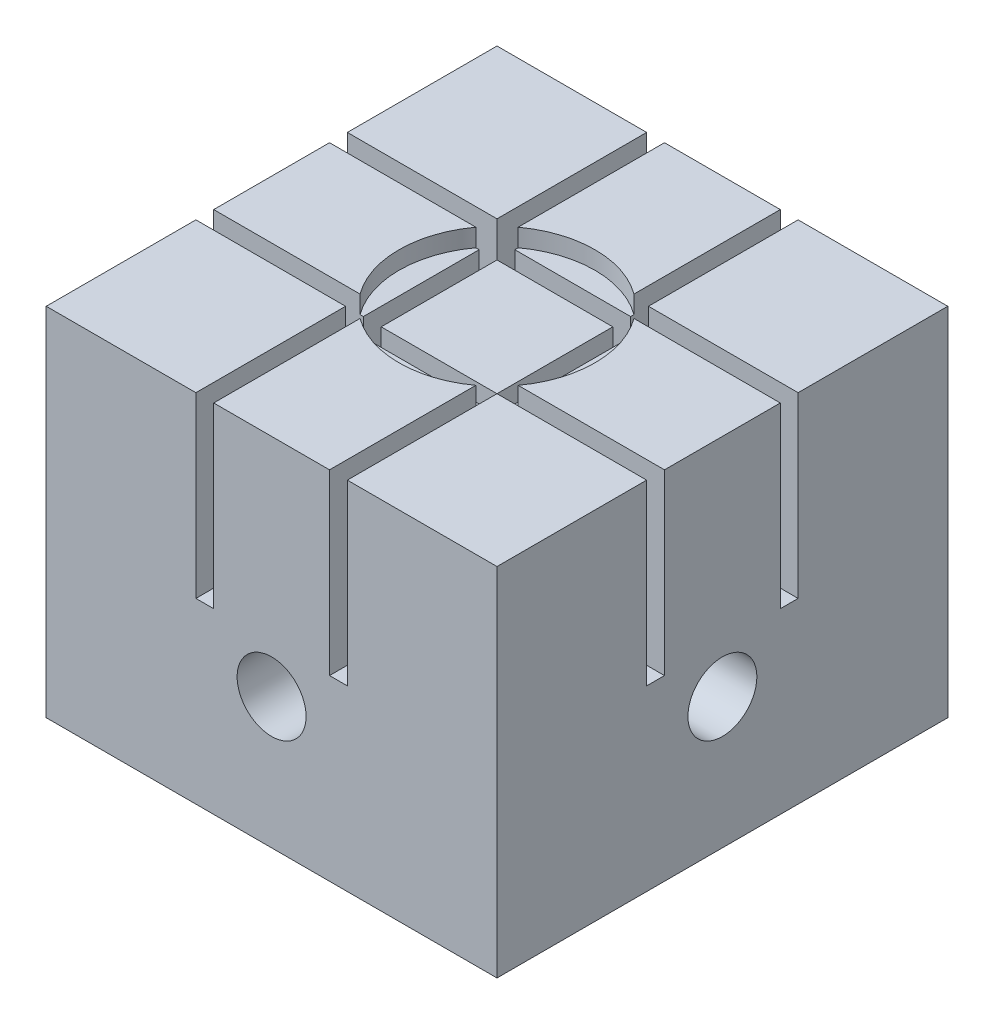
from build123d import *

# Parameters (mm, degrees)
SKETCH1_W                        = 32.131
SKETCH1_H                        = 25.4
BOSS_EXTRUDE1_DEPTH              = 32.131
SKETCH2_W                        = 1.27
SKETCH2_H                        = 32.131
SKETCH2_W_2                      = 32.131
SKETCH2_H_2                      = 1.27
CUT_EXTRUDE1_DEPTH               = 12.7
SKETCH3_R                        = 6.985
CUT_EXTRUDE2_DEPTH               = 1.27
F_10_0_1935_DIAMETER_HOLE6_D     = 4.9149
F_10_0_1935_DIAMETER_HOLE6_DEPTH = 7.62
F_10_0_1935_DIAMETER_HOLE6_TIP   = 1.476584928
F_10_0_1935_DIAMETER_HOLE7_D     = 4.9149
F_10_0_1935_DIAMETER_HOLE7_DEPTH = 7.62
F_10_0_1935_DIAMETER_HOLE7_TIP   = 1.476584928
F_10_0_1935_DIAMETER_HOLE8_D     = 4.9149
F_10_0_1935_DIAMETER_HOLE8_DEPTH = 7.62
F_10_0_1935_DIAMETER_HOLE8_TIP   = 1.476584928
F_10_0_1935_DIAMETER_HOLE9_D     = 4.9149
F_10_0_1935_DIAMETER_HOLE9_DEPTH = 7.62
F_10_0_1935_DIAMETER_HOLE9_TIP   = 1.476584928


with BuildPart() as part:
    # Sketch1 → Boss-Extrude1 (new body)
    with BuildSketch(Plane.XY):
        with Locations((0, 3.3655)):
            Rectangle(SKETCH1_W, SKETCH1_H)
    extrude(amount=BOSS_EXTRUDE1_DEPTH)

    # Sketch2 → Cut-Extrude1 (cut)
    with BuildSketch(Plane(origin=(0, 16.0655, 0), x_dir=(1, 0, 0), z_dir=(0, 1, 0))):
        with Locations((-4.7625, -16.0655)):
            Rectangle(SKETCH2_W, SKETCH2_H)
        with Locations((4.7625, -16.0655)):
            Rectangle(SKETCH2_W, SKETCH2_H)
        with Locations((0, -11.303)):
            Rectangle(SKETCH2_W_2, SKETCH2_H_2)
        with Locations((0, -20.828)):
            Rectangle(SKETCH2_W_2, SKETCH2_H_2)
    extrude(amount=-CUT_EXTRUDE1_DEPTH, mode=Mode.SUBTRACT)

    # Sketch3 → Cut-Extrude2 (cut)
    with BuildSketch(Plane(origin=(0, 16.0655, 0), x_dir=(1, 0, 0), z_dir=(0, 1, 0))):
        with Locations((0, -16.0655)):
            Circle(SKETCH3_R)
    extrude(amount=-CUT_EXTRUDE2_DEPTH, mode=Mode.SUBTRACT)

    # #10 (0.1935) Diameter Hole6
    with Locations(Plane.XY.offset(32.131)):
        with Locations((0, 0)):
            Hole(F_10_0_1935_DIAMETER_HOLE6_D / 2, depth=F_10_0_1935_DIAMETER_HOLE6_DEPTH)
            with Locations((0, 0, -(F_10_0_1935_DIAMETER_HOLE6_DEPTH + F_10_0_1935_DIAMETER_HOLE6_TIP / 2))):  # 118° drill point
                Cone(0, F_10_0_1935_DIAMETER_HOLE6_D / 2, F_10_0_1935_DIAMETER_HOLE6_TIP, mode=Mode.SUBTRACT)

    # #10 (0.1935) Diameter Hole7
    with Locations(Plane(origin=(0, 0, 0), x_dir=(-1, 0, 0), z_dir=(0, 0, -1))):
        with Locations((0, 0)):
            Hole(F_10_0_1935_DIAMETER_HOLE7_D / 2, depth=F_10_0_1935_DIAMETER_HOLE7_DEPTH)
            with Locations((0, 0, -(F_10_0_1935_DIAMETER_HOLE7_DEPTH + F_10_0_1935_DIAMETER_HOLE7_TIP / 2))):  # 118° drill point
                Cone(0, F_10_0_1935_DIAMETER_HOLE7_D / 2, F_10_0_1935_DIAMETER_HOLE7_TIP, mode=Mode.SUBTRACT)

    # #10 (0.1935) Diameter Hole8
    with Locations(Plane(origin=(16.0655, 0, 0), x_dir=(0, 0, -1), z_dir=(1, 0, 0))):
        with Locations((-16.0655, 0)):
            Hole(F_10_0_1935_DIAMETER_HOLE8_D / 2, depth=F_10_0_1935_DIAMETER_HOLE8_DEPTH)
            with Locations((0, 0, -(F_10_0_1935_DIAMETER_HOLE8_DEPTH + F_10_0_1935_DIAMETER_HOLE8_TIP / 2))):  # 118° drill point
                Cone(0, F_10_0_1935_DIAMETER_HOLE8_D / 2, F_10_0_1935_DIAMETER_HOLE8_TIP, mode=Mode.SUBTRACT)

    # #10 (0.1935) Diameter Hole9
    with Locations(Plane.ZY.offset(16.0655)):
        with Locations((16.0655, 0)):
            Hole(F_10_0_1935_DIAMETER_HOLE9_D / 2, depth=F_10_0_1935_DIAMETER_HOLE9_DEPTH)
            with Locations((0, 0, -(F_10_0_1935_DIAMETER_HOLE9_DEPTH + F_10_0_1935_DIAMETER_HOLE9_TIP / 2))):  # 118° drill point
                Cone(0, F_10_0_1935_DIAMETER_HOLE9_D / 2, F_10_0_1935_DIAMETER_HOLE9_TIP, mode=Mode.SUBTRACT)


solid = part.part
